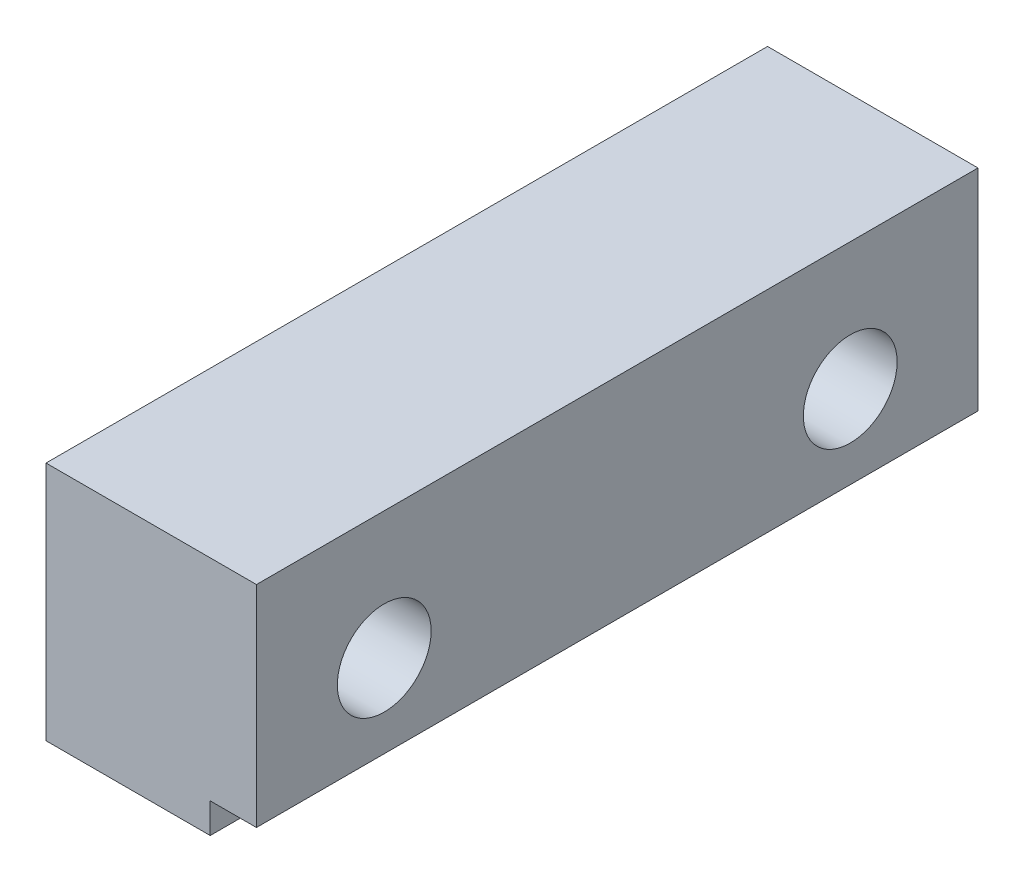
from build123d import *

# Parameters (mm, degrees)
SKETCH1_W           = 44.45
SKETCH1_H           = 50.8
BOSS_EXTRUDE1_DEPTH = 76.2
CUT_EXTRUDE1_REACH  = 93.801
SKETCH2_R           = 6.731
SKETCH3_R           = 9.906
CUT_EXTRUDE2_DEPTH  = 38.608
SKETCH4_W           = 9.764994968
SKETCH4_H           = 6.35
CUT_EXTRUDE4_DEPTH  = 157.092506627


with BuildPart() as part:
    # Sketch1 → Boss-Extrude1 (new, symmetric)
    with BuildSketch(Plane.XY):
        Rectangle(SKETCH1_W, SKETCH1_H)
    extrude(amount=BOSS_EXTRUDE1_DEPTH, both=True)

    # Sketch2 → Cut-Extrude1 (cut, up to next)
    with BuildSketch(Plane(origin=(22.225, 0, 0), x_dir=(0, 0, -1), z_dir=(1, 0, 0)), mode=Mode.PRIVATE) as cut_extrude1_sk1:
        with Locations((-49.2125, -1.524)):
            Circle(SKETCH2_R)
    cut_extrude1_tool1 = extrude(cut_extrude1_sk1.sketch, amount=-CUT_EXTRUDE1_REACH, mode=Mode.PRIVATE) & part.part
    # Sketch2 → Cut-Extrude1 (cut, up to next)
    with BuildSketch(Plane(origin=(22.225, 0, 0), x_dir=(0, 0, -1), z_dir=(1, 0, 0)), mode=Mode.PRIVATE) as cut_extrude1_sk2:
        with Locations((49.2125, -1.524)):
            Circle(SKETCH2_R)
    cut_extrude1_tool2 = extrude(cut_extrude1_sk2.sketch, amount=-CUT_EXTRUDE1_REACH, mode=Mode.PRIVATE) & part.part
    add(cut_extrude1_tool1.solids().sort_by_distance((22.225, -1.524, 49.2125))[0], mode=Mode.SUBTRACT)
    add(cut_extrude1_tool2.solids().sort_by_distance((22.225, -1.524, -49.2125))[0], mode=Mode.SUBTRACT)

    # Sketch3 → Cut-Extrude2 (cut)
    with BuildSketch(Plane(origin=(22.225, 0, 0), x_dir=(0, 0, -1), z_dir=(1, 0, 0))):
        with Locations((-49.2125, -1.524)):
            Circle(SKETCH3_R)
        with Locations((49.2125, -1.524)):
            Circle(SKETCH3_R)
    extrude(amount=-CUT_EXTRUDE2_DEPTH, mode=Mode.SUBTRACT)

    # Sketch4 → Cut-Extrude4 (cut, through all)
    with BuildSketch(Plane.XY.offset(76.2)):
        with Locations((17.342502516, -22.225)):
            Rectangle(SKETCH4_W, SKETCH4_H)
    extrude(amount=-CUT_EXTRUDE4_DEPTH, mode=Mode.SUBTRACT)


solid = part.part
